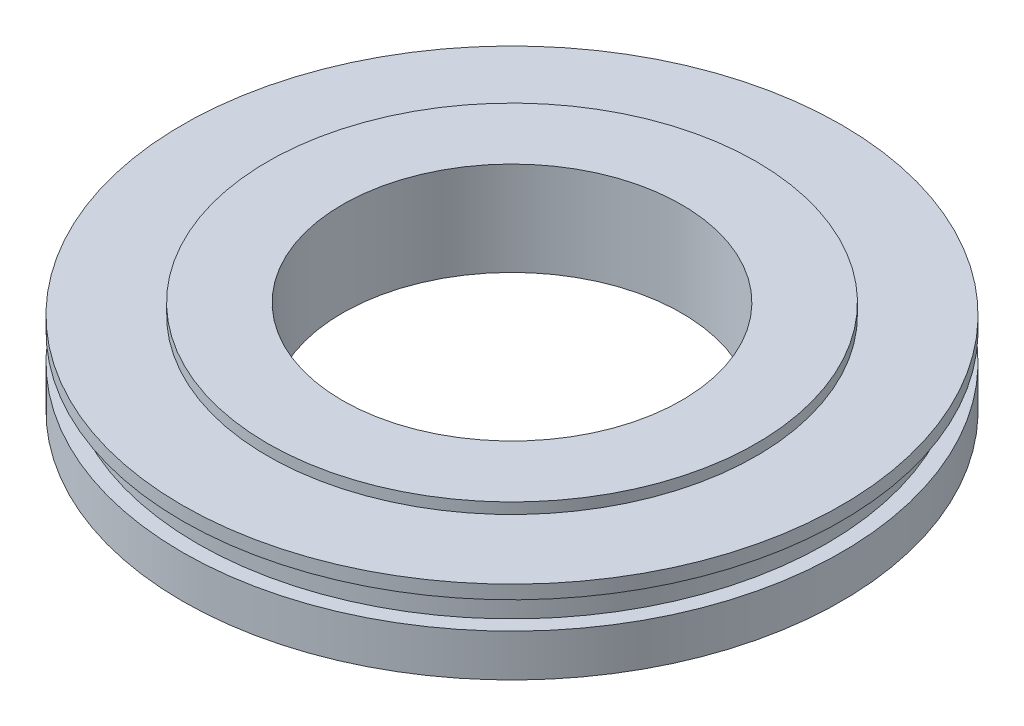
from build123d import *

# Parameters (mm, degrees)
BANDAID_START                  = 0.053848
SKETCH3_R                      = 30.84068
SKETCH3_R_2                    = 15.875
BANDAID_SOLUTION_THICKER_DEPTH = 0.053848
SKETCH4_R                      = 22.86
SKETCH4_R_2                    = 15.875
LIP_FOR_BEARING_DEPTH          = 1.016


with BuildPart() as part:
    # Sketch1 → Revolve1 (revolve)
    with BuildSketch(Plane(origin=(0, 0, 0), x_dir=(0, 0, -1), z_dir=(1, 0, 0))):
        Polygon((-15.875, 2.694084), (-15.875, -5.020818), (-30.84068, -5.020818), (-30.84068, -1.062068), (-29.43479, -1.062068), (-29.43479, 1.477932), (-30.84068, 1.477932), (-30.84068, 2.694084), align=None)
    revolve(axis=Axis((0, 0, 0), (0, -1, 0)))

    # Sketch3 → BandAid Solution thicker (add)
    with BuildSketch(Plane(origin=(0, 2.694084, 0), x_dir=(1, 0, 0), z_dir=(0, 1, 0)).offset(BANDAID_START)):
        with Locations(Location((0, 0, 0), (0, 0, 270))):
            Circle(SKETCH3_R)
        with Locations(Location((0, 0, 0), (0, 0, 270))):
            Circle(SKETCH3_R_2, mode=Mode.SUBTRACT)
    extrude(amount=-BANDAID_SOLUTION_THICKER_DEPTH)

    # Sketch4 → Lip for Bearing (add)
    with BuildSketch(Plane(origin=(0, 2.747932, 0), x_dir=(1, 0, 0), z_dir=(0, 1, 0))):
        with Locations(Location((0, 0, 0), (0, 0, 90))):
            Circle(SKETCH4_R)
        with Locations(Location((0, 0, 0), (0, 0, 270))):
            Circle(SKETCH4_R_2, mode=Mode.SUBTRACT)
    extrude(amount=LIP_FOR_BEARING_DEPTH)


solid = part.part
